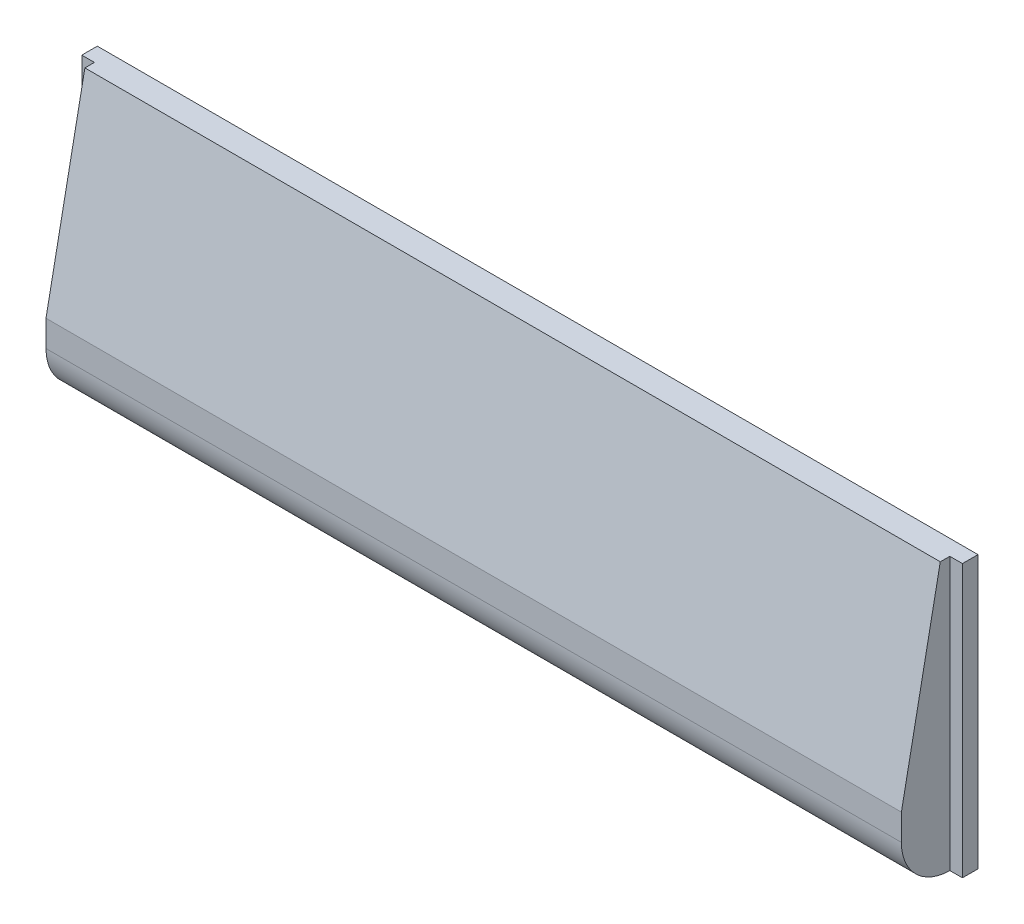
from build123d import *

# Parameters (mm, degrees)
ESQUISSE1_W             = 45.3
ESQUISSE1_H             = 14
BOSS_EXTRU_1_DEPTH      = 0.8
ESQUISSE2_W             = 44
ESQUISSE2_H             = 14
BOSS_EXTRU_2_DEPTH      = 5
ENL_V_MAT_EXTRU_1_DEPTH = 57


with BuildPart() as part:
    # Esquisse1 → Boss.-Extru.1 (new body)
    with BuildSketch(Plane.XY):
        Rectangle(ESQUISSE1_W, ESQUISSE1_H)
    extrude(amount=BOSS_EXTRU_1_DEPTH)

    # Esquisse2 → Boss.-Extru.2 (add)
    with BuildSketch(Plane.XY.offset(0.8)):
        Rectangle(ESQUISSE2_W, ESQUISSE2_H)
    extrude(amount=BOSS_EXTRU_2_DEPTH)

    # Esquisse4 → Enlèv. mat.-Extru.1 (cut)
    with BuildSketch(Plane.ZY.offset(22)):
        with BuildLine():
            Line((1.29, 7), (3.29, -3.15))
            Line((3.29, -3.15), (3.29, -4.5))
            ThreePointArc((3.29, -4.5), (2.561300162, -6.264234962), (0.8, -7))
            Line((0.8, -7), (9.633506855, -10.676835967))
            Line((9.633506855, -10.676835967), (7.497371295, 9.595509349))
            Line((7.497371295, 9.595509349), (1.29, 7))
        make_face()
    extrude(amount=-ENL_V_MAT_EXTRU_1_DEPTH, mode=Mode.SUBTRACT)


solid = part.part
